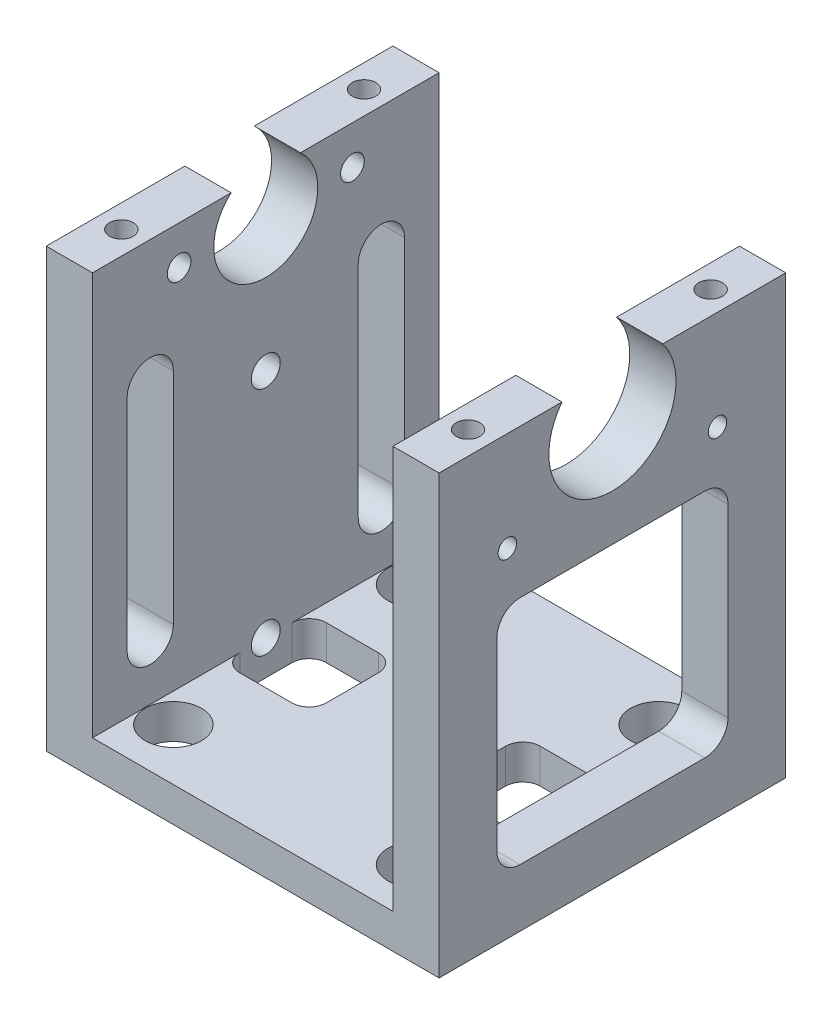
from build123d import *

# Parameters (mm, degrees)
EXTRUDE_1_DEPTH               = 15
CHAMFER_1_SIZE                = 10
SKETCH_2_R                    = 4.5
CUT_EXTRUDE_1_DEPTH           = 58.976288256
SKETCH_3_W                    = 20
SKETCH_3_H                    = 20
CUT_EXTRUDE_2_DEPTH           = 10
FILLET_1_R                    = 2
SKETCH_4_W                    = 9
SKETCH_4_H                    = 28
CUT_EXTRUDE_3_DEPTH           = 1
FILLET_2_R                    = 2
HOLE_WIZARD_M2_2_D            = 1.6
HOLE_WIZARD_M2_2_DEPTH        = 6
HOLE_WIZARD_M2_2_TIP          = 0.480688495
CUT_EXTRUDE_4_DEPTH           = 58.976288256
EXTRUDE_2_DEPTH               = 4
EXTRUDE_3_DEPTH               = 4
CUT_EXTRUDE_5_DEPTH           = 4
SKETCH_12_W                   = 7.5
SKETCH_12_H                   = 7.5
CUT_EXTRUDE_6_DEPTH           = 4
FILLET_3_R                    = 1.5
HOLE_WIZARD_M3_1_D            = 2.5
HOLE_WIZARD_M3_1_DEPTH        = 8.5
HOLE_WIZARD_M3_1_TIP          = 0.751075774
SKETCH_17_R                   = 4.875
CUT_EXTRUDE_8_DEPTH           = 1
FILLET_4_R                    = 1.5
HOLE_WIZARD_M2_5_1_AT_2_COUNT = 2
HOLE_WIZARD_M2_5_1_AT_2_PITCH = 21
HOLE_WIZARD_M2_5_2_D          = 2.05
HOLE_WIZARD_M2_5_2_DEPTH      = 6.25
HOLE_WIZARD_M2_5_2_TIP        = 0.615882135
SKETCH_24_R                   = 2.435
CUT_EXTRUDE_9_DEPTH           = 10
SKETCH_25_R                   = 5.5
CUT_EXTRUDE_10_DEPTH          = 10


with BuildPart() as part:
    # 草图1 → 凸台-拉伸1 (new, symmetric)
    with BuildSketch(Plane.XY):
        Polygon((0, 0), (34, 0), (34, 44.5), (30, 44.5), (30, 4), (30, 3), (4, 3), (4, 4), (4, 42), (0, 42), align=None)
    extrude(amount=EXTRUDE_1_DEPTH, both=True)

    # 倒角1
    chamfer_1_edges = [part.edges().sort_by_distance(p)[0] for p in [
        (32, 44.5, -15),
        (32, 44.5, 15),
        (2, 42, 15),
        (2, 42, -15),
    ]]
    chamfer(chamfer_1_edges, length=CHAMFER_1_SIZE)

    # 草图2 → 切除-拉伸1 (cut, through all)
    with BuildSketch(Plane(origin=(34, 0, 0), x_dir=(0, 0, -1), z_dir=(1, 0, 0))):
        with Locations((0, 34.5)):
            Circle(SKETCH_2_R)
    extrude(amount=-CUT_EXTRUDE_1_DEPTH, mode=Mode.SUBTRACT)

    # 草图3 → 切除-拉伸2 (cut)
    with BuildSketch(Plane(origin=(34, 0, 0), x_dir=(0, 0, -1), z_dir=(1, 0, 0))):
        with Locations((0, 15)):
            Rectangle(SKETCH_3_W, SKETCH_3_H)
    extrude(amount=-CUT_EXTRUDE_2_DEPTH, mode=Mode.SUBTRACT)

    # 圆角1
    fillet_1_edges = [part.edges().sort_by_distance(p)[0] for p in [
        (32, 25, -10),
        (32, 5, -10),
        (32, 5, 10),
        (32, 25, 10),
    ]]
    fillet(fillet_1_edges, radius=FILLET_1_R)

    # 草图4 → 切除-拉伸3 (cut)
    with BuildSketch(Plane.ZY):
        with Locations((0, 14)):
            Rectangle(SKETCH_4_W, SKETCH_4_H)
    extrude(amount=-CUT_EXTRUDE_3_DEPTH, mode=Mode.SUBTRACT)

    # 圆角2
    fillet_2_edges = [part.edges().sort_by_distance(p)[0] for p in [
        (0.5, 28, -4.5),
        (0.5, 28, 4.5),
    ]]
    fillet(fillet_2_edges, radius=FILLET_2_R)

    # M2 螺纹孔2
    with Locations(Plane(origin=(34, 29.25, 9.09326674), x_dir=(0, 0, 1), z_dir=(1, 0, 0))):
        with Locations((0, 0), (-18.18653348, 0)):
            Hole(HOLE_WIZARD_M2_2_D / 2, depth=HOLE_WIZARD_M2_2_DEPTH)
            with Locations((0, 0, -(HOLE_WIZARD_M2_2_DEPTH + HOLE_WIZARD_M2_2_TIP / 2))):  # 118° drill point
                Cone(0, HOLE_WIZARD_M2_2_D / 2, HOLE_WIZARD_M2_2_TIP, mode=Mode.SUBTRACT)

    # 草图5 → 切除-拉伸4 (cut, through all)
    with BuildSketch(Plane(origin=(34, 0, 0), x_dir=(0, 0, -1), z_dir=(1, 0, 0))):
        Polygon((-3, 37.854101966), (-15, 37.854101966), (-15, 44.5), (15, 44.5), (15, 37.854101966), align=None)
    extrude(amount=-CUT_EXTRUDE_4_DEPTH, mode=Mode.SUBTRACT)

    # 草图9 → 凸台-拉伸2 (add)
    with BuildSketch(Plane.ZY):
        Polygon((15, 32), (15, 37.854101966), (9.145898034, 37.854101966), align=None)
        Polygon((-15, 37.854101966), (-9.145898034, 37.854101966), (-15, 32), align=None)
    extrude(amount=-EXTRUDE_2_DEPTH)

    # 草图10 → 凸台-拉伸3 (add)
    with BuildSketch(Plane(origin=(34, 0, 0), x_dir=(0, 0, -1), z_dir=(1, 0, 0))):
        Polygon((11.645898034, 37.854101966), (15, 37.854101966), (15, 34.5), align=None)
        Polygon((-15, 34.5), (-15, 37.854101966), (-11.645898034, 37.854101966), align=None)
    extrude(amount=-EXTRUDE_3_DEPTH)

    # 草图11 → 切除-拉伸5 (cut)
    with BuildSketch(Plane.ZY):
        with BuildLine():
            Line((-8, 27), (-8, 8))
            ThreePointArc((-8, 8), (-10, 6), (-12, 8))
            Line((-12, 8), (-12, 27))
            ThreePointArc((-12, 27), (-10, 29), (-8, 27))
        make_face()
        with BuildLine():
            Line((8, 27), (8, 8))
            ThreePointArc((8, 8), (10, 6), (12, 8))
            Line((12, 8), (12, 27))
            ThreePointArc((12, 27), (10, 29), (8, 27))
        make_face()
    extrude(amount=-CUT_EXTRUDE_5_DEPTH, mode=Mode.SUBTRACT)

    # 草图12 → 切除-拉伸6 (cut)
    with BuildSketch(Plane.XZ):
        with Locations((7.75, 0)):
            Rectangle(SKETCH_12_W, SKETCH_12_H)
    cut_extrude_6 = extrude(amount=-CUT_EXTRUDE_6_DEPTH, mode=Mode.SUBTRACT)

    # 圆角3
    fillet_3_edges = [part.edges().sort_by_distance(p)[0] for p in [
        (11.5, 1.5, 3.75),
        (4, 1.5, -3.75),
        (11.5, 1.5, -3.75),
        (4, 1.5, 3.75),
    ]]
    fillet(fillet_3_edges, radius=FILLET_3_R)

    # M3 螺纹孔1
    with Locations(Plane(origin=(1, 23, 0), x_dir=(0, 0, -1), z_dir=(-1, 0, 0))):
        with Locations((0, 0), (0, 20)):
            Hole(HOLE_WIZARD_M3_1_D / 2, depth=HOLE_WIZARD_M3_1_DEPTH)
            with Locations((0, 0, -(HOLE_WIZARD_M3_1_DEPTH + HOLE_WIZARD_M3_1_TIP / 2))):  # 118° drill point
                Cone(0, HOLE_WIZARD_M3_1_D / 2, HOLE_WIZARD_M3_1_TIP, mode=Mode.SUBTRACT)

    # 草图17 → 切除-拉伸8 (cut)
    with BuildSketch(Plane.XZ):
        with Locations(Location((17, 0, 0), (0, 0, 270))):
            Circle(SKETCH_17_R)
    extrude(amount=-CUT_EXTRUDE_8_DEPTH, mode=Mode.SUBTRACT)

    # 镜向2: 切除-拉伸6 across plane
    add(cut_extrude_6.mirror(Plane.ZY.offset(-17)), mode=Mode.SUBTRACT)

    # 圆角4
    fillet_4_edges = [part.edges().sort_by_distance(p)[0] for p in [
        (22.5, 1.5, -3.75),
        (22.5, 1.5, 3.75),
        (30, 1.5, 3.75),
        (30, 1.5, -3.75),
    ]]
    fillet(fillet_4_edges, radius=FILLET_4_R)

    # 草图20 → M2.5 螺纹孔1 (revolve, cut)
    with BuildSketch(Plane(origin=(32, 37.854101966, 10.5), x_dir=(0, 0, 1), z_dir=(1, 0, 0))):
        Polygon((0, 0), (0, 6.865882135), (1.025, 6.25), (1.025, 0), align=None)
    hole_wizard_m2_5_1 = revolve(axis=Axis((32, 44.204101966, 10.5), (0, -1, 0)), mode=Mode.SUBTRACT)

    # M2.5 螺纹孔1 at 2: M2.5 螺纹孔1 ×2
    with Locations(*[(0, 0, -i * HOLE_WIZARD_M2_5_1_AT_2_PITCH) for i in range(1, HOLE_WIZARD_M2_5_1_AT_2_COUNT)]):
        add(hole_wizard_m2_5_1, mode=Mode.SUBTRACT)

    # 镜向3: M2.5 螺纹孔1 across plane
    add(hole_wizard_m2_5_1.mirror(Plane.ZY.offset(-17)), mode=Mode.SUBTRACT)

    # 镜向3 copy 1 sketch → 镜向3 copy 1 (revolve, cut)
    with BuildSketch(Plane(origin=(2, 37.854101966, -10.5), x_dir=(0, 0, 1), z_dir=(-1, 0, 0))):
        Polygon((0, 0), (0, -6.865882135), (1.025, -6.25), (1.025, 0), align=None)
    revolve(axis=Axis((2, 44.204101966, -10.5), (0, 1, 0)), mode=Mode.SUBTRACT)

    # M2.5 螺纹孔2
    with Locations(Plane(origin=(0, 34.5, 7.5), x_dir=(0, 0, -1), z_dir=(-1, 0, 0))):
        with Locations((0, 0), (15, 0)):
            Hole(HOLE_WIZARD_M2_5_2_D / 2, depth=HOLE_WIZARD_M2_5_2_DEPTH)
            with Locations((0, 0, -(HOLE_WIZARD_M2_5_2_DEPTH + HOLE_WIZARD_M2_5_2_TIP / 2))):  # 118° drill point
                Cone(0, HOLE_WIZARD_M2_5_2_D / 2, HOLE_WIZARD_M2_5_2_TIP, mode=Mode.SUBTRACT)

    # 草图24 → 切除-拉伸9 (cut)
    with BuildSketch(Plane.XZ):
        with Locations(Location((6.5, 10.5, 0), (0, 0, 270))):
            Circle(SKETCH_24_R)
        with Locations(Location((27.5, 10.5, 0), (0, 0, 270))):
            Circle(SKETCH_24_R)
        with Locations(Location((6.5, -10.5, 0), (0, 0, 270))):
            Circle(SKETCH_24_R)
        with Locations(Location((27.5, -10.5, 0), (0, 0, 270))):
            Circle(SKETCH_24_R)
    extrude(amount=-CUT_EXTRUDE_9_DEPTH, mode=Mode.SUBTRACT)

    # 草图25 → 切除-拉伸10 (cut)
    with BuildSketch(Plane(origin=(34, 0, 0), x_dir=(0, 0, -1), z_dir=(1, 0, 0))):
        with Locations((0, 34.5)):
            Circle(SKETCH_25_R)
    extrude(amount=-CUT_EXTRUDE_10_DEPTH, mode=Mode.SUBTRACT)


solid = part.part
